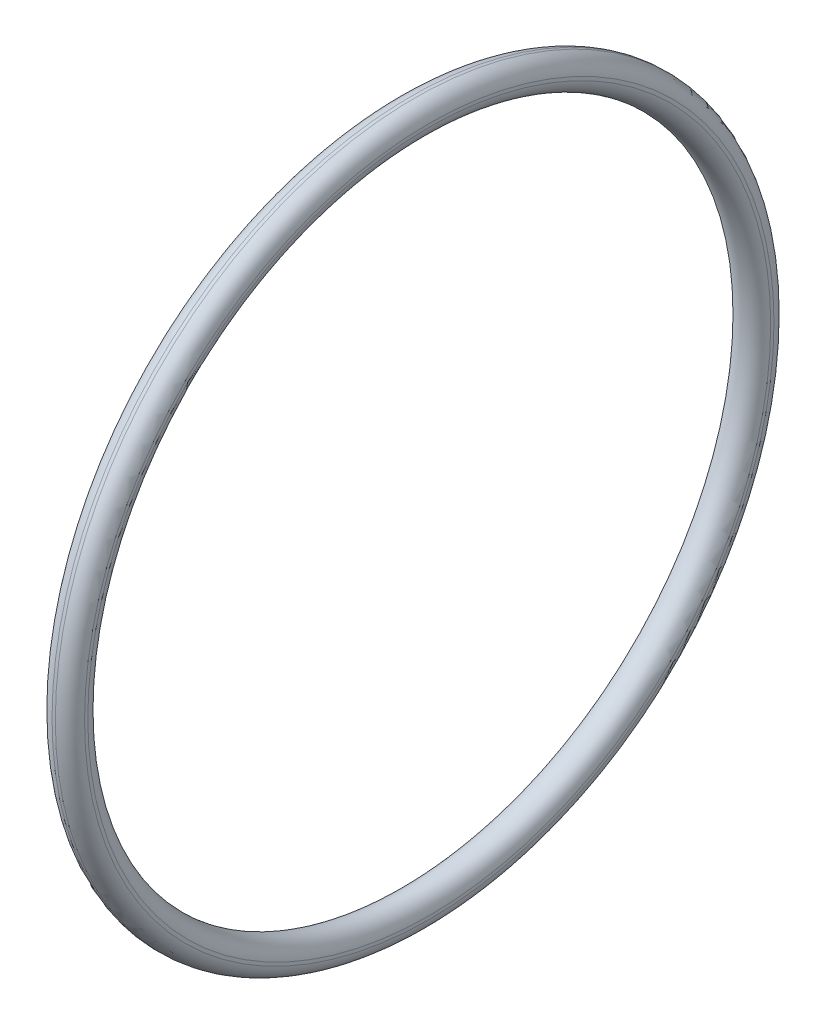
from build123d import *


with BuildPart() as part:
    # Skizze1 → Rotation1 (revolve)
    with BuildSketch(Plane.XY, mode=Mode.PRIVATE) as rotation1_sk:
        with BuildLine():
            Line((-0.2, 43.989974874), (0.2, 43.989974874))
            ThreePointArc((0.2, 43.989974874), (1.414213562, 43.414213562), (1.989974874, 42.2))
            Line((1.989974874, 42.2), (1.989974874, 41.8))
            ThreePointArc((1.989974874, 41.8), (-1.414213562, 40.585786438), (-0.2, 43.989974874))
        make_face()
    revolve(rotation1_sk.sketch.rotate(Axis((0, 0, 0), (1, 0, 0)), 90), axis=Axis((0, 0, 0), (1, 0, 0)))


solid = part.part
